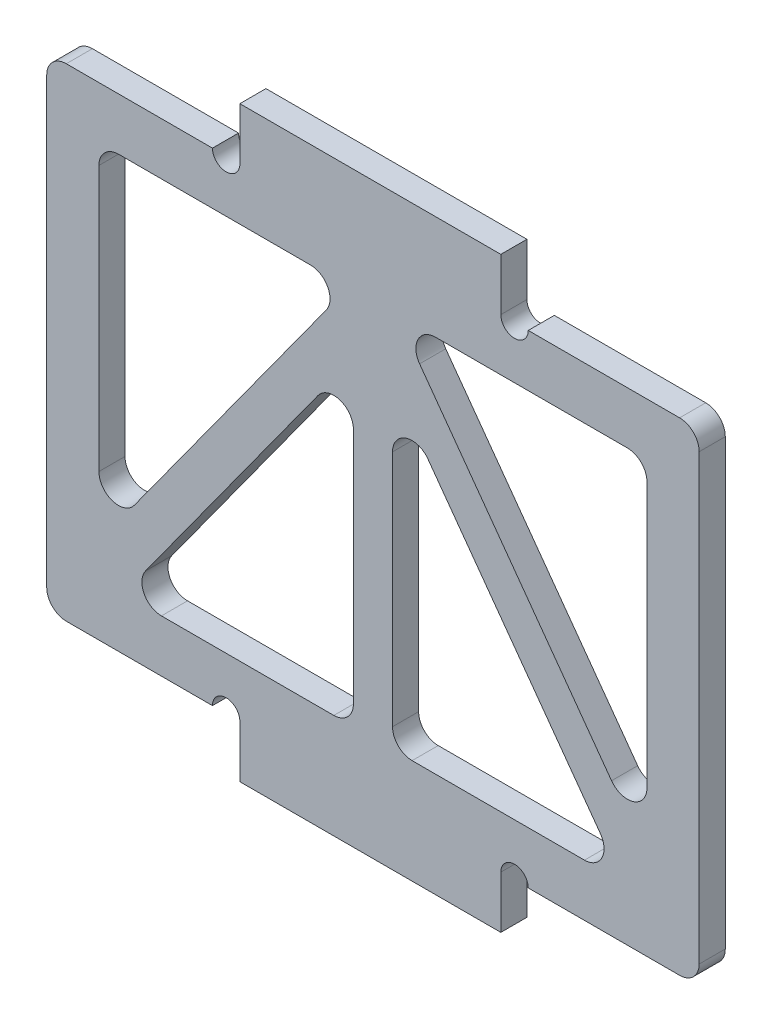
from build123d import *

# Parameters (mm, degrees)
SKETCH_1_W          = 50
SKETCH_1_H          = 37
EXTRUDE_1_DEPTH     = 2
SKETCH_2_W          = 20
SKETCH_2_H          = 2
EXTRUDE_2_DEPTH     = 4
SKETCH_3_R          = 1.05
CUT_EXTRUDE_1_DEPTH = 3
CUT_EXTRUDE_3_DEPTH = 10
FILLET_1_R          = 1.5


with BuildPart() as part:
    # 草图1 → 凸台-拉伸1 (new body)
    with BuildSketch(Plane.XY):
        Rectangle(SKETCH_1_W, SKETCH_1_H)
    extrude(amount=EXTRUDE_1_DEPTH)

    # 草图2 → 凸台-拉伸2 (add)
    with BuildSketch(Plane(origin=(0, 18.5, 0), x_dir=(1, 0, 0), z_dir=(0, 1, 0))):
        with Locations((-0.2, -1)):
            Rectangle(SKETCH_2_W, SKETCH_2_H)
    extrude_2 = extrude(amount=EXTRUDE_2_DEPTH)

    # 镜向1: 凸台-拉伸2 across plane
    add(extrude_2.mirror(Plane.ZX))

    # 草图3 → 切除-拉伸1 (cut)
    with BuildSketch(Plane(origin=(0, 0, 0), x_dir=(-1, 0, 0), z_dir=(0, 0, -1))):
        with Locations((11.25, 18.5)):
            Circle(SKETCH_3_R)
        with Locations((-10.85, 18.5)):
            Circle(SKETCH_3_R)
        with Locations((-10.85, -18.5)):
            Circle(SKETCH_3_R)
        with Locations((11.25, -18.5)):
            Circle(SKETCH_3_R)
    extrude(amount=-CUT_EXTRUDE_1_DEPTH, mode=Mode.SUBTRACT)

    # 草图4 → 切除-拉伸3 (cut)
    with BuildSketch(Plane(origin=(0, 0, 0), x_dir=(-1, 0, 0), z_dir=(0, 0, -1))):
        Polygon((-21, 14.5), (-21, -11.94249803), (-1.851984185, 14.5), align=None)
        Polygon((-19.148015815, -14.5), (-1.5, -14.5), (-1.5, 9.871069459), align=None)
        Polygon((1.5, 9.871069459), (1.5, -14.5), (19.148015815, -14.5), align=None)
        Polygon((1.851984185, 14.5), (21, -11.94249803), (21, 14.5), align=None)
    extrude(amount=-CUT_EXTRUDE_3_DEPTH, mode=Mode.SUBTRACT)

    # 圆角1
    fillet_1_edges = [part.edges().sort_by_distance(p)[0] for p in [
        (-1.851984185, 14.5, 1),
        (-21, 14.5, 1),
        (-21, -11.94249803, 1),
        (1.851984185, 14.5, 1),
        (21, -11.94249803, 1),
        (21, 14.5, 1),
        (25, -18.5, 1),
        (-25, -18.5, 1),
        (-25, 18.5, 1),
        (25, 18.5, 1),
        (1.5, 9.871069459, 1),
        (1.5, -14.5, 1),
        (19.148015815, -14.5, 1),
        (-1.5, 9.871069459, 1),
        (-19.148015815, -14.5, 1),
        (-1.5, -14.5, 1),
    ]]
    fillet(fillet_1_edges, radius=FILLET_1_R)


solid = part.part
